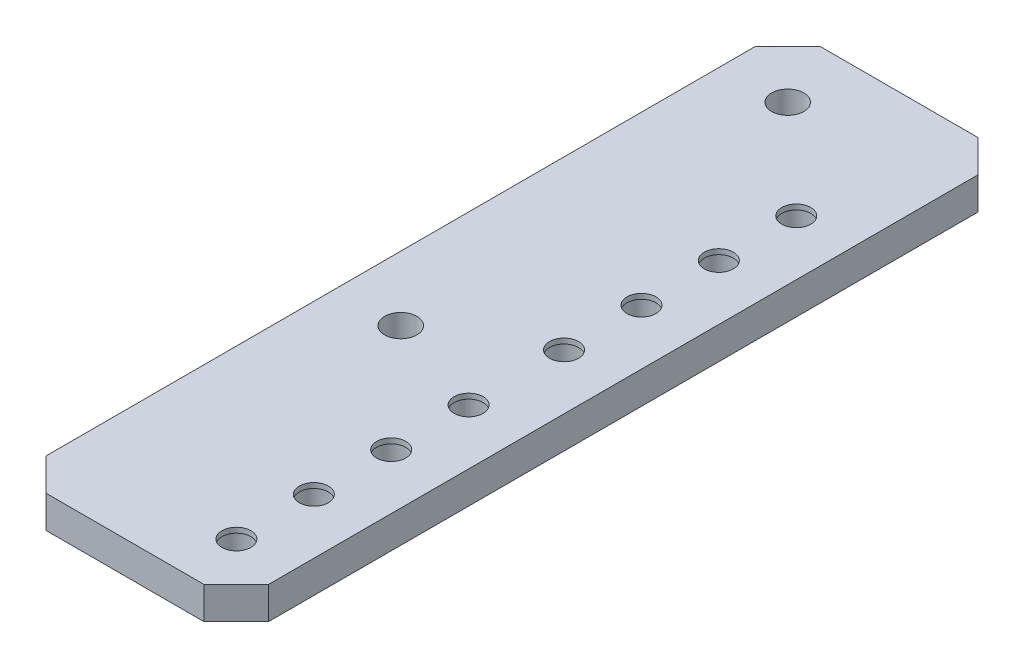
from build123d import *

# Parameters (mm, degrees)
SKETCH1_W                                        = 34.5
SKETCH1_H                                        = 120
BOSS_EXTRUDE1_DEPTH                              = 5
CBORE_FOR_M4_HEX_HEAD_MACHINE_SCREW2_D           = 4.5
CBORE_FOR_M4_HEX_HEAD_MACHINE_SCREW2_DEPTH       = 12
CBORE_FOR_M4_HEX_HEAD_MACHINE_SCREW2_CBORE_D     = 5
CBORE_FOR_M4_HEX_HEAD_MACHINE_SCREW2_CBORE_DEPTH = 4.2
CBORE_FOR_M4_HEX_HEAD_MACHINE_SCREW2_TIP         = 1.351936393
CBORE_FOR_M4_HEX_HEAD_MACHINE_SCREW3_AT_COUNT    = 2
CBORE_FOR_M4_HEX_HEAD_MACHINE_SCREW3_AT_PITCH    = 50.8
LPATTERN1_COUNT                                  = 4
LPATTERN1_PITCH                                  = 12
CHAMFER1_SIZE                                    = 5


with BuildPart() as part:
    # Sketch1 → Boss-Extrude1 (new body)
    with BuildSketch(Plane(origin=(0, 0, 0), x_dir=(1, 0, 0), z_dir=(0, 1, 0))):
        Rectangle(SKETCH1_W, SKETCH1_H)
    extrude(amount=BOSS_EXTRUDE1_DEPTH)

    # CBORE for M4 Hex Head Machine Screw2
    with Locations(Plane(origin=(0, 5, 0), x_dir=(1, 0, 0), z_dir=(0, 1, 0))):
        with Locations((-7.25, 50), (-7.25, -10)):
            CounterBoreHole(CBORE_FOR_M4_HEX_HEAD_MACHINE_SCREW2_D / 2, CBORE_FOR_M4_HEX_HEAD_MACHINE_SCREW2_CBORE_D / 2, CBORE_FOR_M4_HEX_HEAD_MACHINE_SCREW2_CBORE_DEPTH, depth=CBORE_FOR_M4_HEX_HEAD_MACHINE_SCREW2_DEPTH)
            with Locations((0, 0, -(CBORE_FOR_M4_HEX_HEAD_MACHINE_SCREW2_DEPTH + CBORE_FOR_M4_HEX_HEAD_MACHINE_SCREW2_TIP / 2))):  # 118° drill point
                Cone(0, CBORE_FOR_M4_HEX_HEAD_MACHINE_SCREW2_D / 2, CBORE_FOR_M4_HEX_HEAD_MACHINE_SCREW2_TIP, mode=Mode.SUBTRACT)

    # Sketch6 → CBORE for M4 Hex Head Machine Screw3 (revolve, cut)
    with BuildSketch(Plane(origin=(8.672, 0, -35.4), x_dir=(0, 0, -1), z_dir=(1, 0, 0))):
        Polygon((0, 0), (0, 13.351936393), (2.25, 12), (2.25, 4.2), (2.5, 4.2), (2.5, 0), align=None)
    cbore_for_m4_hex_head_machine_screw3 = revolve(axis=Axis((8.672, -6.35, -35.4), (0, 1, 0)), mode=Mode.SUBTRACT)

    # CBORE for M4 Hex Head Machine Screw3 at: CBORE for M4 Hex Head Machine Screw3 ×2
    with Locations(*[(0, 0, i * CBORE_FOR_M4_HEX_HEAD_MACHINE_SCREW3_AT_PITCH) for i in range(1, CBORE_FOR_M4_HEX_HEAD_MACHINE_SCREW3_AT_COUNT)]):
        add(cbore_for_m4_hex_head_machine_screw3, mode=Mode.SUBTRACT)

    # LPattern1: CBORE for M4 Hex Head Machine Screw3 ×4
    with Locations(*[(0, 0, i * LPATTERN1_PITCH) for i in range(1, LPATTERN1_COUNT)]):
        add(cbore_for_m4_hex_head_machine_screw3, mode=Mode.SUBTRACT)

    # LPattern1 copy 1 sketch → LPattern1 copy 1 (revolve, cut)
    with BuildSketch(Plane(origin=(8.672, 0, 27.4), x_dir=(0, 0, -1), z_dir=(1, 0, 0))):
        Polygon((0, 0), (0, 13.351936393), (2.25, 12), (2.25, 4.2), (2.5, 4.2), (2.5, 0), align=None)
    revolve(axis=Axis((8.672, -6.35, 27.4), (0, 1, 0)), mode=Mode.SUBTRACT)

    # LPattern1 copy 2 sketch → LPattern1 copy 2 (revolve, cut)
    with BuildSketch(Plane(origin=(8.672, 0, 39.4), x_dir=(0, 0, -1), z_dir=(1, 0, 0))):
        Polygon((0, 0), (0, 13.351936393), (2.25, 12), (2.25, 4.2), (2.5, 4.2), (2.5, 0), align=None)
    revolve(axis=Axis((8.672, -6.35, 39.4), (0, 1, 0)), mode=Mode.SUBTRACT)

    # LPattern1 copy 3 sketch → LPattern1 copy 3 (revolve, cut)
    with BuildSketch(Plane(origin=(8.672, 0, 51.4), x_dir=(0, 0, -1), z_dir=(1, 0, 0))):
        Polygon((0, 0), (0, 13.351936393), (2.25, 12), (2.25, 4.2), (2.5, 4.2), (2.5, 0), align=None)
    revolve(axis=Axis((8.672, -6.35, 51.4), (0, 1, 0)), mode=Mode.SUBTRACT)

    # Chamfer1
    chamfer1_edges = [part.edges().sort_by_distance(p)[0] for p in [
        (17.25, 2.5, 60),
        (-17.25, 2.5, 60),
        (-17.25, 2.5, -60),
        (17.25, 2.5, -60),
    ]]
    chamfer(chamfer1_edges, length=CHAMFER1_SIZE)


solid = part.part
